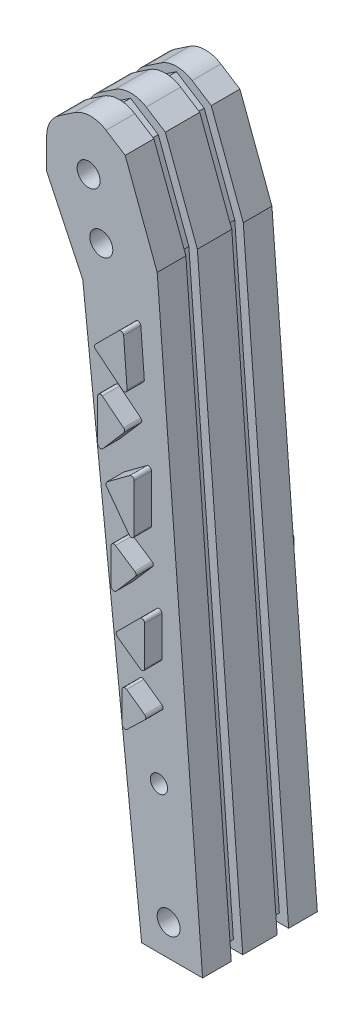
from build123d import *

# Parameters (mm, degrees)
EXTRUDE_1_DEPTH     = 20
CUT_EXTRUDE_START   = 3
CUT_EXTRUDE_1_DEPTH = 2
EXTRUDE_2_DEPTH     = 3
SKETCH_115_R        = 2
SKETCH_115_R_2      = 1.5
CUT_EXTRUDE_2_DEPTH = 279.143495269
FILLET_1_R          = 5
SKETCH_116_R        = 2
CUT_EXTRUDE_3_DEPTH = 279.143495269


with BuildPart() as part:
    # 草图1 → 凸台-拉伸1 (new body)
    with BuildSketch(Plane(origin=(0, 0, 0), x_dir=(-1, 0, 0), z_dir=(0, 0, 1))):
        Polygon((74.438153655, 158.80166336), (74.438153655, 150.81385389), (66.84370456, 145.696765598), (60.754110218, 149.581447702), (55.174801085, 164.459776844), (47.261962171, 267.008923523), (57.886031057, 267.008923523), (68.150536307, 171.985087167), align=None)
    extrude(amount=EXTRUDE_1_DEPTH)

    # 草图113 → 切除-拉伸1 (cut)
    with BuildSketch(Plane(origin=(0, 0, 10), x_dir=(-1, 0, 0), z_dir=(0, 0, -1)).offset(CUT_EXTRUDE_START)):
        Polygon((55.174801085, -164.459776844), (47.261962171, -267.008923523), (57.886031057, -267.008923523), (68.150536307, -171.985087167), (74.438153655, -158.80166336), (74.438153655, -150.81385389), (66.84370456, -145.696765598), (60.754110218, -149.581447702), align=None)
        Polygon((56.653989783, -164.787273226), (48.882163106, -265.508923523), (56.539335626, -265.508923523), (66.686650777, -171.56997655), (72.938153655, -158.462274967), (72.938153655, -151.61189122), (66.821209313, -147.490335609), (61.982843766, -150.576832179), align=None, mode=Mode.SUBTRACT)
    cut_extrude_1 = extrude(amount=CUT_EXTRUDE_1_DEPTH, mode=Mode.SUBTRACT)

    # 镜向1: 切除-拉伸1 across plane
    add(cut_extrude_1.mirror(Plane(origin=(0, 0, 10), x_dir=(1, 0, 0), z_dir=(0, 0, -1))), mode=Mode.SUBTRACT)

    # 草图114 → 凸台-拉伸2 (add)
    with BuildSketch(Plane(origin=(0, 0, 0), x_dir=(-1, 0, 0), z_dir=(0, 0, -1))):
        with BuildLine():
            Line((58.025627707, -173.935710741), (57.419339245, -181.793113798))
            ThreePointArc((57.419339245, -181.793113798), (57.684559456, -182.273815488), (58.231058467, -182.221330198))
            Line((58.231058467, -182.221330198), (62.923737604, -178.450317813))
            ThreePointArc((62.923737604, -178.450317813), (63.109801357, -178.087671778), (62.964089914, -177.707014396))
            Line((62.964089914, -177.707014396), (58.877699239, -173.620623723))
            ThreePointArc((58.877699239, -173.620623723), (58.350728284, -173.505214058), (58.025627707, -173.935710741))
        make_face()
        with BuildLine():
            Line((60.934012548, -197.454954781), (56.971204979, -194.518647305))
            ThreePointArc((56.971204979, -194.518647305), (56.448628412, -194.473820011), (56.173532656, -194.920382527))
            Line((56.173532656, -194.920382527), (56.173532659, -203.204850558))
            ThreePointArc((56.173532659, -203.204850558), (56.516796592, -203.679649258), (57.07526788, -203.50252288))
            Line((57.07526788, -203.50252288), (61.038075447, -198.154362325))
            ThreePointArc((61.038075447, -198.154362325), (61.130896043, -197.783106421), (60.934012548, -197.454954781))
        make_face()
        with BuildLine():
            Line((57.978905554, -188.563420266), (61.66084791, -192.808841031))
            ThreePointArc((61.66084791, -192.808841031), (62.213413835, -192.949681307), (62.538578919, -192.481244809))
            Line((62.538578919, -192.481244809), (62.538578917, -185.277034446))
            ThreePointArc((62.538578917, -185.277034446), (62.25468012, -184.826146133), (61.725377837, -184.887284419))
            Line((61.725377837, -184.887284419), (58.043435482, -187.846074018))
            ThreePointArc((58.043435482, -187.846074018), (57.858647408, -188.191026703), (57.978905554, -188.563420266))
        make_face()
        with BuildLine():
            Line((59.442872047, -206.313835661), (56.081759275, -208.539915803))
            ThreePointArc((56.081759275, -208.539915803), (55.862445165, -208.889140713), (55.980118188, -209.284374538))
            Line((55.980118188, -209.284374538), (59.341230961, -213.159866488))
            ThreePointArc((59.341230961, -213.159866488), (59.893796886, -213.300706764), (60.218961971, -212.832270266))
            Line((60.218961971, -212.832270266), (60.218961969, -206.730698174))
            ThreePointArc((60.218961969, -206.730698174), (59.955557657, -206.290218344), (59.442872047, -206.313835661))
        make_face()
        with BuildLine():
            Line((59.180756665, -219.162865233), (55.202116295, -215.184224865))
            ThreePointArc((55.202116295, -215.184224865), (54.657221188, -215.07583849), (54.348562904, -215.537778256))
            Line((54.348562904, -215.537778256), (54.348562906, -222.366147911))
            ThreePointArc((54.348562906, -222.366147911), (54.620062064, -222.810880826), (55.139712367, -222.772635293))
            Line((55.139712367, -222.772635293), (59.118352735, -219.922906006))
            ThreePointArc((59.118352735, -219.922906006), (59.325526398, -219.557333957), (59.180756665, -219.162865233))
        make_face()
        with BuildLine():
            Line((57.496934877, -227.057752455), (54.36647935, -229.299963354))
            ThreePointArc((54.36647935, -229.299963354), (54.158945852, -229.670183565), (54.310729697, -230.066535456))
            Line((54.310729697, -230.066535456), (57.441185226, -233.082359755))
            ThreePointArc((57.441185226, -233.082359755), (57.983724881, -233.182410645), (58.288084339, -232.722275036))
            Line((58.288084339, -232.722275036), (58.288084338, -227.464239836))
            ThreePointArc((58.288084338, -227.464239836), (58.01658518, -227.019506922), (57.496934877, -227.057752455))
        make_face()
    extrude_2 = extrude(amount=EXTRUDE_2_DEPTH)

    # 镜向2: 凸台-拉伸2 across plane
    add(extrude_2.mirror(Plane(origin=(0, 0, 10), x_dir=(1, 0, 0), z_dir=(0, 0, -1))))

    # 草图115 → 切除-拉伸2 (cut, through all)
    with BuildSketch(Plane(origin=(0, 0, 0), x_dir=(-1, 0, 0), z_dir=(0, 0, -1))):
        with Locations((64.915803172, -164.949805196)):
            Circle(SKETCH_115_R)
        with Locations((67.132054217, -155.644675734)):
            Circle(SKETCH_115_R)
        with Locations((54.86719071, -241.489374019)):
            Circle(SKETCH_115_R_2)
    extrude(amount=-CUT_EXTRUDE_2_DEPTH, mode=Mode.SUBTRACT)

    # 圆角1
    fillet_1_edges = [part.edges().sort_by_distance(p)[0] for p in [
        (-74.438153655, -150.81385389, 17.5),
        (-66.84370456, -145.696765598, 17.5),
        (-74.438153655, -150.81385389, 2.5),
        (-66.84370456, -145.696765598, 2.5),
        (-66.84370456, -145.696765598, 10),
        (-74.438153655, -150.81385389, 10),
    ]]
    fillet(fillet_1_edges, radius=FILLET_1_R)

    # 草图116 → 切除-拉伸3 (cut, through all)
    with BuildSketch(Plane(origin=(0, 0, 0), x_dir=(-1, 0, 0), z_dir=(0, 0, -1))):
        with Locations((53.184824598, -261.558408948)):
            Circle(SKETCH_116_R)
    extrude(amount=-CUT_EXTRUDE_3_DEPTH, mode=Mode.SUBTRACT)


solid = part.part
